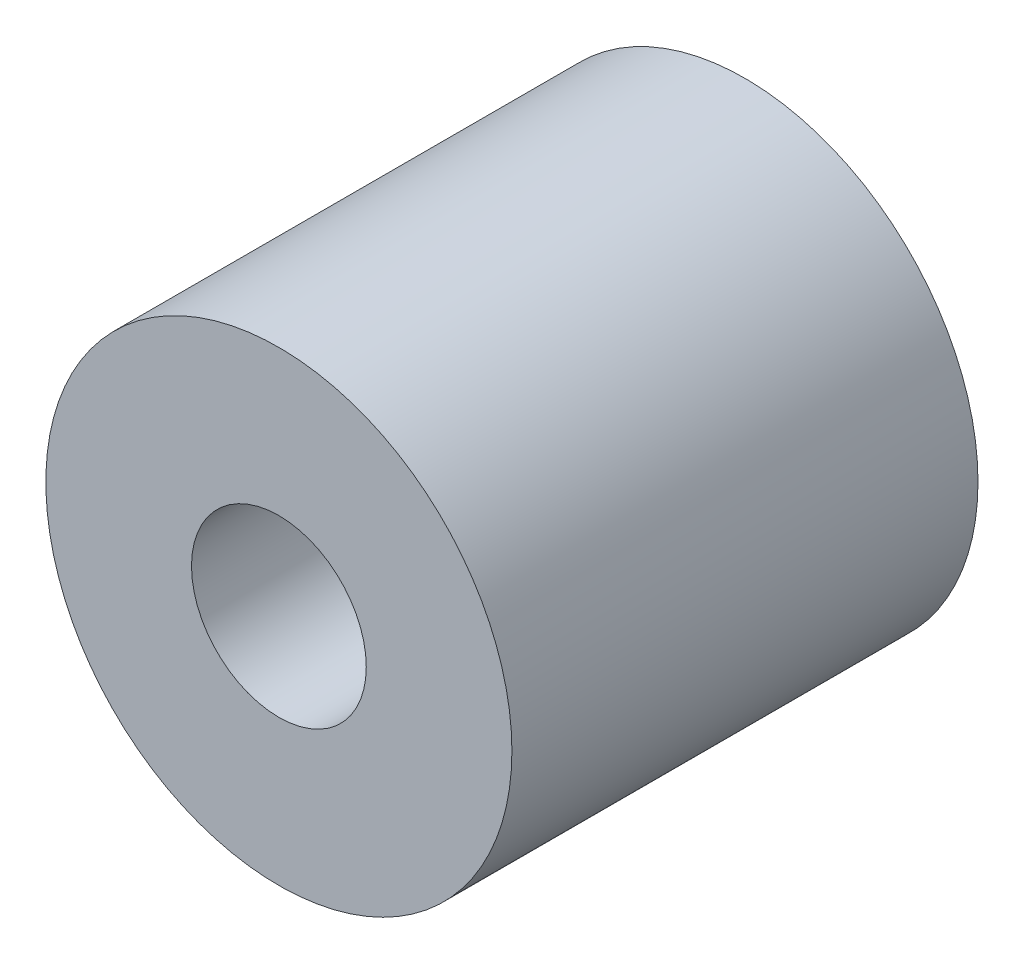
from build123d import *

# Parameters (mm, degrees)
SKETCH1_R           = 4
SKETCH1_R_2         = 3
BOSS_EXTRUDE1_DEPTH = 8
BOSS_EXTRUDE2_START = -5.5
SKETCH2_R           = 3
SKETCH2_R_2         = 1.5
BOSS_EXTRUDE2_DEPTH = 5.5


with BuildPart() as part:
    # Sketch1 → Boss-Extrude1 (new body)
    with BuildSketch(Plane.XY):
        Circle(SKETCH1_R)
        Circle(SKETCH1_R_2, mode=Mode.SUBTRACT)
    extrude(amount=BOSS_EXTRUDE1_DEPTH)

    # Sketch2 → Boss-Extrude2 (add)
    with BuildSketch(Plane.XY.offset(8).offset(BOSS_EXTRUDE2_START)):
        Circle(SKETCH2_R)
        Circle(SKETCH2_R_2, mode=Mode.SUBTRACT)
    extrude(amount=BOSS_EXTRUDE2_DEPTH)


solid = part.part
